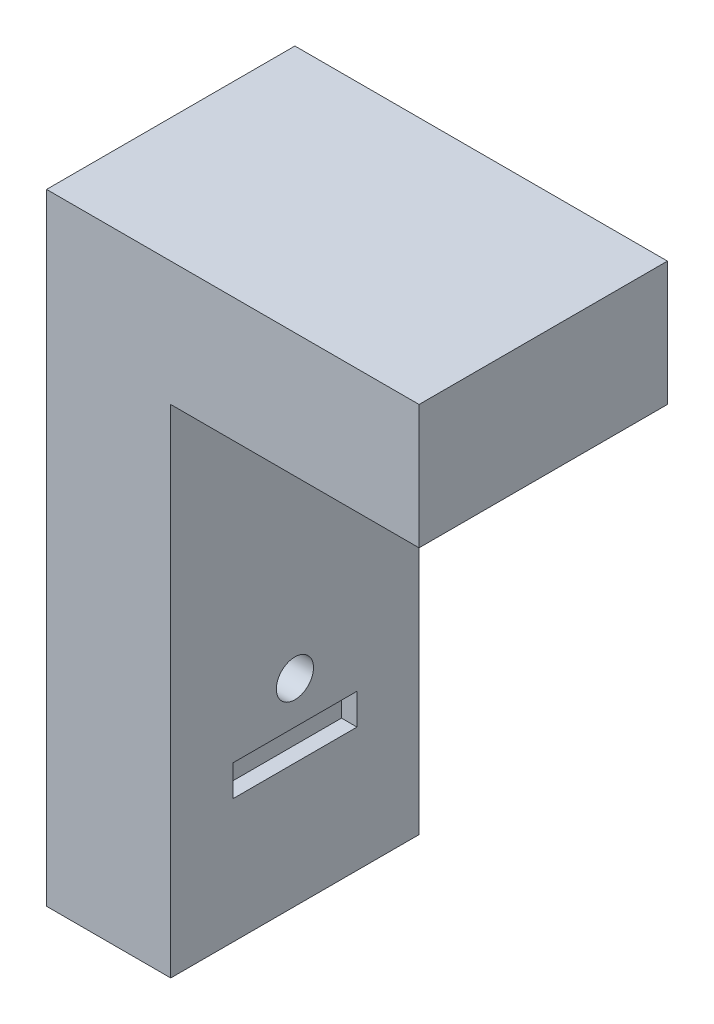
from build123d import *

# Parameters (mm, degrees)
BOSS_EXTRUDE1_DEPTH                               = 25.4
SKETCH2_W                                         = 12.7
SKETCH2_H                                         = 3.175
CUT_EXTRUDE1_DEPTH                                = 1.5875
CSK_FOR_6_FLAT_HEAD_MACHINE_SCREW_100_D           = 3.7973
CSK_FOR_6_FLAT_HEAD_MACHINE_SCREW_100_DEPTH       = 25.4
CSK_FOR_6_FLAT_HEAD_MACHINE_SCREW_100_CSINK_D     = 7.0866
CSK_FOR_6_FLAT_HEAD_MACHINE_SCREW_100_CSINK_ANGLE = 100
CSK_FOR_6_FLAT_HEAD_MACHINE_SCREW_100_TIP         = 1.140824014


with BuildPart() as part:
    # Sketch1 → Boss-Extrude1 (new body)
    with BuildSketch(Plane.XY):
        Polygon((-12.7, 0), (-12.7, 63.5), (25.4, 63.5), (25.4, 50.8), (0, 50.8), (0, 0), align=None)
    extrude(amount=-BOSS_EXTRUDE1_DEPTH)

    # Sketch2 → Cut-Extrude1 (cut)
    with BuildSketch(Plane(origin=(0, 0, 0), x_dir=(0, 0, -1), z_dir=(1, 0, 0))):
        with Locations((12.7, 14.2875)):
            Rectangle(SKETCH2_W, SKETCH2_H)
    extrude(amount=-CUT_EXTRUDE1_DEPTH, mode=Mode.SUBTRACT)

    # CSK for #6 Flat Head Machine Screw (100)1
    with Locations(Plane(origin=(-12.7, -5.150678534, -61.119160157), x_dir=(0, 0, 1), z_dir=(-1, 0, 0))):
        with Locations((48.419160157, 25.344845691)):
            CounterSinkHole(CSK_FOR_6_FLAT_HEAD_MACHINE_SCREW_100_D / 2, CSK_FOR_6_FLAT_HEAD_MACHINE_SCREW_100_CSINK_D / 2, depth=CSK_FOR_6_FLAT_HEAD_MACHINE_SCREW_100_DEPTH, counter_sink_angle=CSK_FOR_6_FLAT_HEAD_MACHINE_SCREW_100_CSINK_ANGLE)
            with Locations((0, 0, -(CSK_FOR_6_FLAT_HEAD_MACHINE_SCREW_100_DEPTH + CSK_FOR_6_FLAT_HEAD_MACHINE_SCREW_100_TIP / 2))):  # 118° drill point
                Cone(0, CSK_FOR_6_FLAT_HEAD_MACHINE_SCREW_100_D / 2, CSK_FOR_6_FLAT_HEAD_MACHINE_SCREW_100_TIP, mode=Mode.SUBTRACT)


solid = part.part
